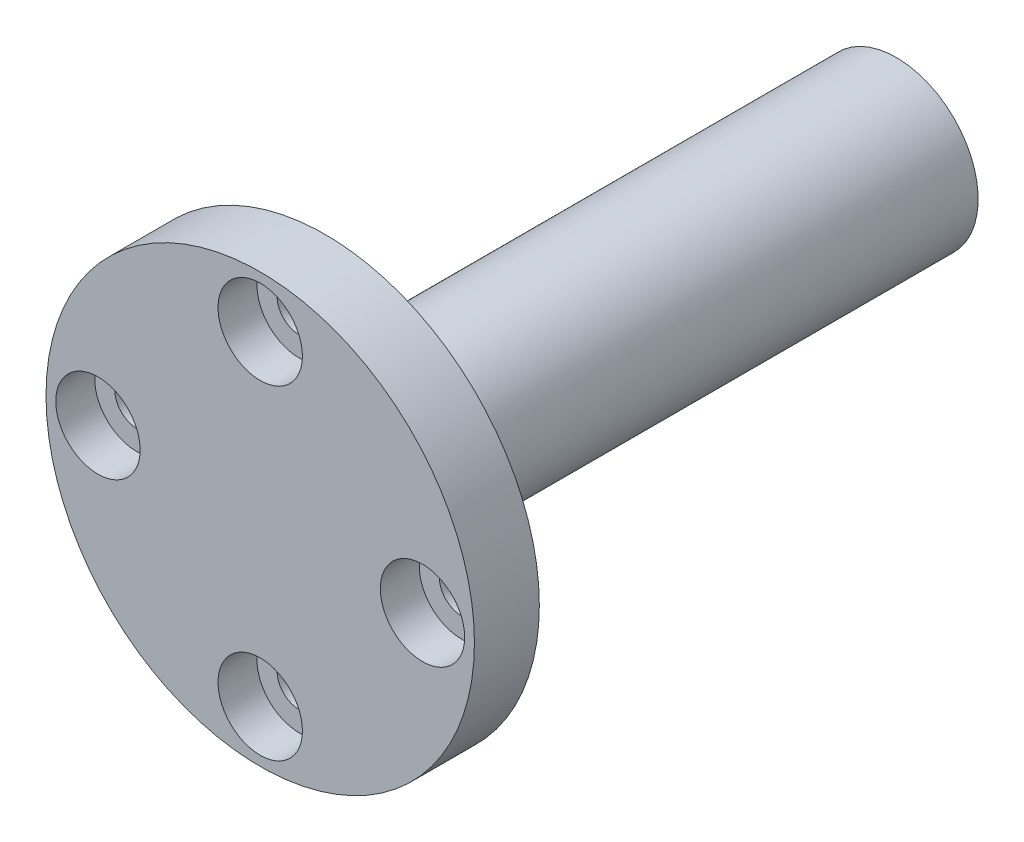
from build123d import *

# Parameters (mm, degrees)
HOLE_WIZARD_M31_D           = 3.4
HOLE_WIZARD_M31_CBORE_D     = 6.5
HOLE_WIZARD_M31_CBORE_DEPTH = 3
M3X0_51_D                   = 2.5
M3X0_51_DEPTH               = 15
M3X0_51_TIP                 = 0.751075774


with BuildPart() as part:
    # Эскиз2 → Повернуть1 (revolve)
    with BuildSketch(Plane(origin=(0, 0, 0), x_dir=(0, 0, -1), z_dir=(1, 0, 0)), mode=Mode.PRIVATE) as revolve_1_sk:
        Polygon((0, 0), (0, 16.5), (5, 16.5), (5, 6.3), (49, 6.3), (49, 0), align=None)
    revolve(revolve_1_sk.sketch.rotate(Axis((0, 0, -49), (0, 0, 1)), 90), axis=Axis((0, 0, -49), (0, 0, 1)))

    # Цековка для винта с внутренним шестигранником M31 (through all)
    with Locations(Plane.XY):
        with Locations((-12.5, 0), (0, 12.5), (12.5, 0), (0, -12.5)):
            CounterBoreHole(HOLE_WIZARD_M31_D / 2, HOLE_WIZARD_M31_CBORE_D / 2, HOLE_WIZARD_M31_CBORE_DEPTH)

    # Отверстие обработанное метчиком M3x0.51
    with Locations(Plane(origin=(2.706733298, -7.232806727, -49), x_dir=(-0.6355249951810988, -0.7720802940757291, 0), z_dir=(0, 0, -1))):
        with Locations((-3.864110878, 6.686444901)):
            Hole(M3X0_51_D / 2, depth=M3X0_51_DEPTH)
            with Locations((0, 0, -(M3X0_51_DEPTH + M3X0_51_TIP / 2))):  # 118° drill point
                Cone(0, M3X0_51_D / 2, M3X0_51_TIP, mode=Mode.SUBTRACT)


solid = part.part
